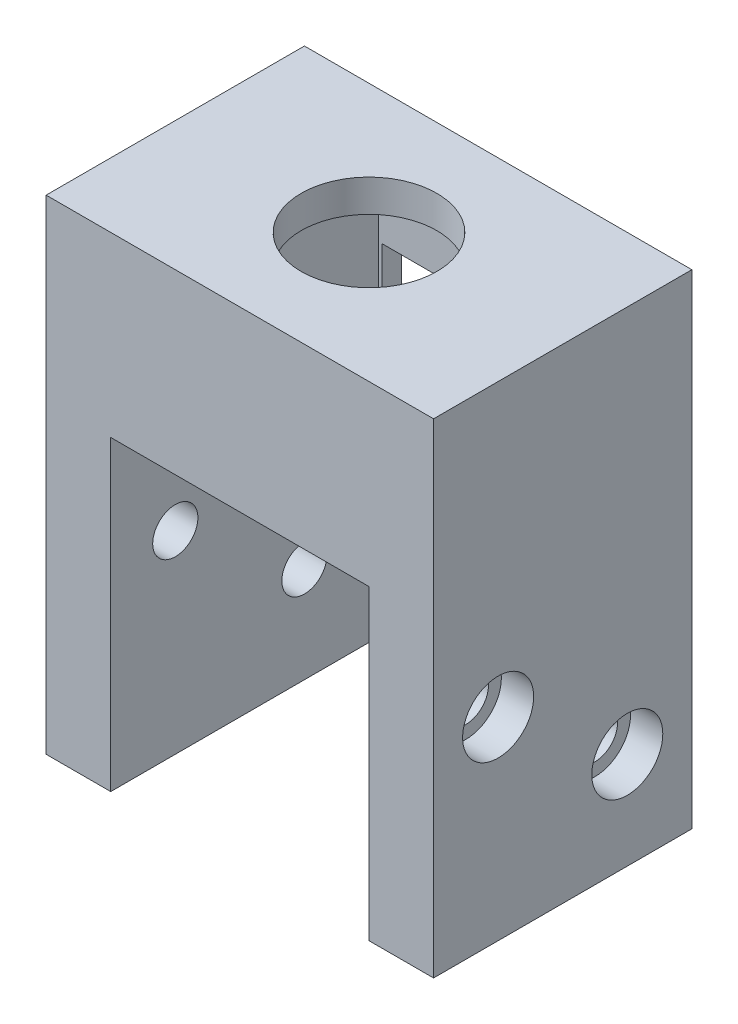
from build123d import *

# Parameters (mm, degrees)
SKETCH_1_W          = 8
SKETCH_1_H          = 8
SKETCH_1_R          = 2.1
EXTRUDE_1_DEPTH     = 1
EXTRUDE_START       = 1
SKETCH_1_6_W        = 2
SKETCH_1_6_H        = 8
EXTRUDE_2_DEPTH     = 15
EXTRUDE_2_2_DEPTH   = 15
SKETCH_2_W          = 0.9
SKETCH_2_H          = 0.6
SKETCH_2_W_2        = 6.2
SKETCH_2_H_2        = 6.8
EXTRUDE_3_DEPTH     = 4.5
CUT_EXTRUDE_1_REACH = 19.205
SKETCH_3_W          = 1.6
SKETCH_3_H          = 2
SKETCH_4_R          = 0.7
CUT_EXTRUDE_2_DEPTH = 19.867962264
SKETCH_4_3_R        = 1.1
CUT_EXTRUDE_3_DEPTH = 1
CUT_EXTRUDE_START   = -11
SKETCH_4_4_R        = 1.1
CUT_EXTRUDE_4_DEPTH = 1


with BuildPart() as part:
    # 草图1 → 凸台-拉伸1 (new body)
    with BuildSketch(Plane(origin=(0, 0, 0), x_dir=(1, 0, 0), z_dir=(0, 1, 0))):
        Rectangle(SKETCH_1_W, SKETCH_1_H)
        with Locations(Location((0, 0, 0), (0, 0, 270))):
            Circle(SKETCH_1_R, mode=Mode.SUBTRACT)
    extrude(amount=EXTRUDE_1_DEPTH)



with BuildPart() as body_2:
    # 草图1<6> → 凸台-拉伸2 (new body)
    with BuildSketch(Plane(origin=(0, 0, 0), x_dir=(1, 0, 0), z_dir=(0, 1, 0)).offset(EXTRUDE_START)):
        with Locations((-5, 0)):
            Rectangle(SKETCH_1_6_W, SKETCH_1_6_H)
    extrude(amount=-EXTRUDE_2_DEPTH)


with BuildPart() as body_3:
    # 草图1<6> → Extrude 2 2 (new body)
    with BuildSketch(Plane(origin=(0, 0, 0), x_dir=(1, 0, 0), z_dir=(0, 1, 0)).offset(EXTRUDE_START)):
        with Locations((5, 0)):
            Rectangle(SKETCH_1_6_W, SKETCH_1_6_H)
    extrude(amount=-EXTRUDE_2_2_DEPTH)


with BuildPart() as part_1:
    add(part.part)

    add(body_2.part)  # 凸台-拉伸3 merges body 2

    add(body_3.part)  # 凸台-拉伸3 merges body 3
    # 草图2 → 凸台-拉伸3 (add)
    with BuildSketch(Plane.XZ):
        with Locations((-3.55, 3.7)):
            Rectangle(SKETCH_2_W, SKETCH_2_H)
        with Locations((0, 3.7)):
            Rectangle(SKETCH_2_W_2, SKETCH_2_H)
        with Locations((3.55, 3.7)):
            Rectangle(SKETCH_2_W, SKETCH_2_H)
        with Locations((3.55, 0)):
            Rectangle(SKETCH_2_W, SKETCH_2_H_2)
        with Locations((3.55, -3.7)):
            Rectangle(SKETCH_2_W, SKETCH_2_H)
        with Locations((0, -3.7)):
            Rectangle(SKETCH_2_W_2, SKETCH_2_H)
        with Locations((-3.55, -3.7)):
            Rectangle(SKETCH_2_W, SKETCH_2_H)
        with Locations((-3.55, 0)):
            Rectangle(SKETCH_2_W, SKETCH_2_H_2)
    extrude(amount=EXTRUDE_3_DEPTH)

    # 草图3 → 切除-拉伸1 (cut, up to next)
    with BuildSketch(Plane(origin=(0, 0, -4), x_dir=(-1, 0, 0), z_dir=(0, 0, -1)), mode=Mode.PRIVATE) as cut_extrude_1_sk1:
        with Locations((-2.2, -3.5)):
            Rectangle(SKETCH_3_W, SKETCH_3_H)
    cut_extrude_1_tool1 = extrude(cut_extrude_1_sk1.sketch, amount=-CUT_EXTRUDE_1_REACH, mode=Mode.PRIVATE) & part_1.part
    # 草图3 → 切除-拉伸1 (cut, up to next)
    with BuildSketch(Plane(origin=(0, 0, -4), x_dir=(-1, 0, 0), z_dir=(0, 0, -1)), mode=Mode.PRIVATE) as cut_extrude_1_sk2:
        with Locations((2.2, -3.5)):
            Rectangle(SKETCH_3_W, SKETCH_3_H)
    cut_extrude_1_tool2 = extrude(cut_extrude_1_sk2.sketch, amount=-CUT_EXTRUDE_1_REACH, mode=Mode.PRIVATE) & part_1.part
    add(cut_extrude_1_tool1.solids().sort_by_distance((2.2, -3.5, -4))[0], mode=Mode.SUBTRACT)
    add(cut_extrude_1_tool2.solids().sort_by_distance((-2.2, -3.5, -4))[0], mode=Mode.SUBTRACT)

    # 草图4 → 切除-拉伸2 (cut, through all)
    with BuildSketch(Plane(origin=(6, 0, 0), x_dir=(0, 0, -1), z_dir=(1, 0, 0))):
        with Locations((-2, -8)):
            Circle(SKETCH_4_R)
        with Locations((2, -11)):
            Circle(SKETCH_4_R)
    extrude(amount=-CUT_EXTRUDE_2_DEPTH, mode=Mode.SUBTRACT)

    # 草图4<3> → 切除-拉伸3 (cut)
    with BuildSketch(Plane(origin=(6, 0, 0), x_dir=(0, 0, -1), z_dir=(1, 0, 0))):
        with Locations((-2, -8)):
            Circle(SKETCH_4_3_R)
        with Locations((2, -11)):
            Circle(SKETCH_4_3_R)
    extrude(amount=-CUT_EXTRUDE_3_DEPTH, mode=Mode.SUBTRACT)

    # 草图4<4> → 切除-拉伸4 (cut)
    with BuildSketch(Plane(origin=(6, 0, 0), x_dir=(0, 0, -1), z_dir=(1, 0, 0)).offset(CUT_EXTRUDE_START)):
        with Locations((-2, -8)):
            Circle(SKETCH_4_4_R)
        with Locations((2, -11)):
            Circle(SKETCH_4_4_R)
    extrude(amount=-CUT_EXTRUDE_4_DEPTH, mode=Mode.SUBTRACT)


solid = part_1.part
